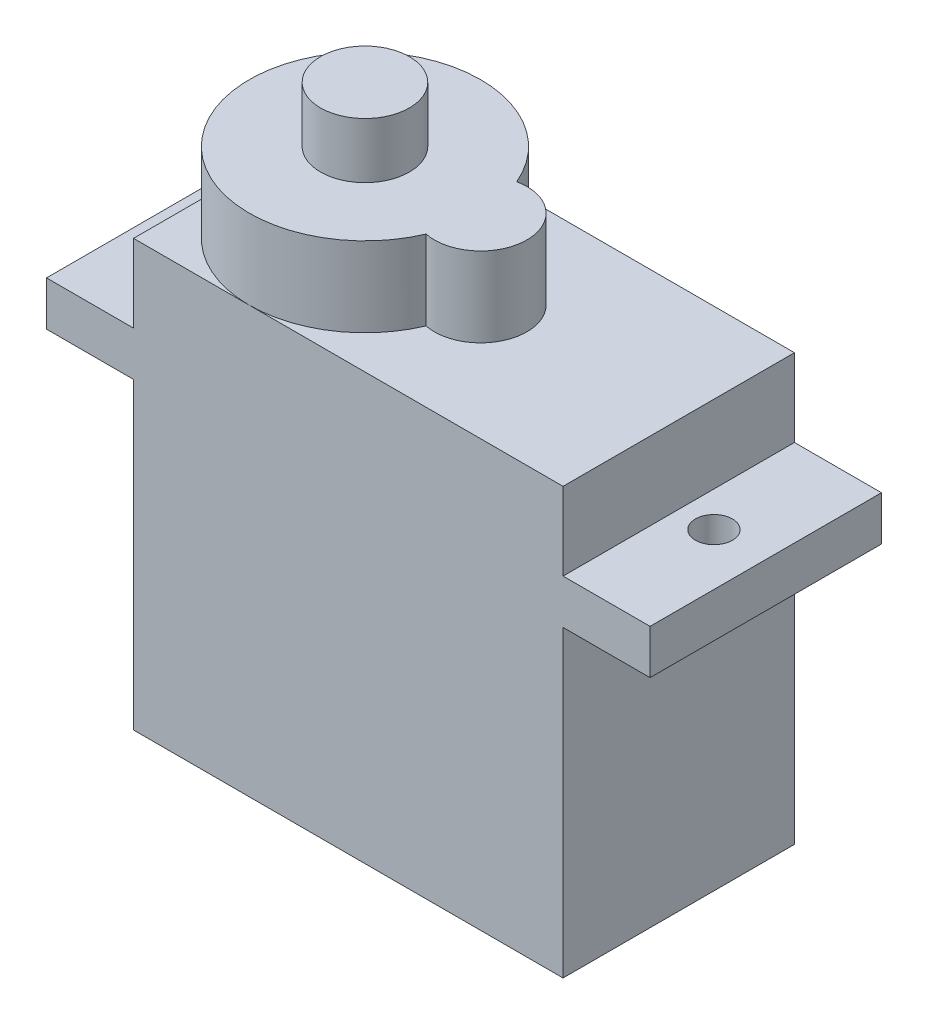
from build123d import *

# Parameters (mm, degrees)
SKETCH2_W           = 23.2
SKETCH2_H           = 12.5
BOSS_EXTRUDE1_DEPTH = 16.4
SKETCH3_W           = 32.6
SKETCH3_H           = 12.5
SKETCH3_R           = 1
BOSS_EXTRUDE2_DEPTH = 2.4
SKETCH4_W           = 23.2
SKETCH4_H           = 12.5
BOSS_EXTRUDE3_DEPTH = 4.2
SKETCH5_R           = 6.25
SKETCH5_R_2         = 2.5
BOSS_EXTRUDE4_DEPTH = 4.3
SKETCH6_R           = 2.400000026
BOSS_EXTRUDE5_DEPTH = 3
SKETCH7_R           = 0.5
BOSS_EXTRUDE8_DEPTH = 2.54


with BuildPart() as part:
    # Sketch2 → Boss-Extrude1 (new body)
    with BuildSketch(Plane(origin=(0, 0, 0), x_dir=(1, 0, 0), z_dir=(0, 1, 0))):
        with Locations((11.6, 6.25)):
            Rectangle(SKETCH2_W, SKETCH2_H)
    extrude(amount=BOSS_EXTRUDE1_DEPTH)

    # Sketch3 → Boss-Extrude2 (add)
    with BuildSketch(Plane(origin=(0, 16.4, 0), x_dir=(1, 0, 0), z_dir=(0, 1, 0))):
        with Locations((11.6, 6.25)):
            Rectangle(SKETCH3_W, SKETCH3_H)
        with Locations(Location((-1.9, 6.25, 0), (0, 0, 270))):
            Circle(SKETCH3_R, mode=Mode.SUBTRACT)
        with Locations(Location((25.1, 6.25, 0), (0, 0, 270))):
            Circle(SKETCH3_R, mode=Mode.SUBTRACT)
    extrude(amount=BOSS_EXTRUDE2_DEPTH)

    # Sketch4 → Boss-Extrude3 (add)
    with BuildSketch(Plane(origin=(0, 18.8, 0), x_dir=(1, 0, 0), z_dir=(0, 1, 0))):
        with Locations((11.6, 6.25)):
            Rectangle(SKETCH4_W, SKETCH4_H)
    extrude(amount=BOSS_EXTRUDE3_DEPTH)

    # Sketch5 → Boss-Extrude4 (add)
    with BuildSketch(Plane(origin=(0, 23, 0), x_dir=(1, 0, 0), z_dir=(0, 1, 0))):
        with Locations((6.25, 6.25)):
            Circle(SKETCH5_R)
        with Locations((12.5, 6.25)):
            Circle(SKETCH5_R_2)
    extrude(amount=BOSS_EXTRUDE4_DEPTH)

    # Sketch6 → Boss-Extrude5 (add)
    with BuildSketch(Plane(origin=(0, 27.3, 0), x_dir=(1, 0, 0), z_dir=(0, 1, 0))):
        with Locations(Location((6.25, 6.25, 0), (0, 0, 270))):
            Circle(SKETCH6_R)
    extrude(amount=BOSS_EXTRUDE5_DEPTH)

    # Sketch7 → Boss-Extrude8 (add)
    with BuildSketch(Plane.ZY):
        with Locations(Location((-6.25, 5, 0), (0, 0, 180))):
            Circle(SKETCH7_R)
        with Locations(Location((-7.266, 5, 0), (0, 0, 180))):
            Circle(SKETCH7_R)
        with Locations(Location((-5.234, 5, 0), (0, 0, 180))):
            Circle(SKETCH7_R)
    extrude(amount=BOSS_EXTRUDE8_DEPTH)


solid = part.part
